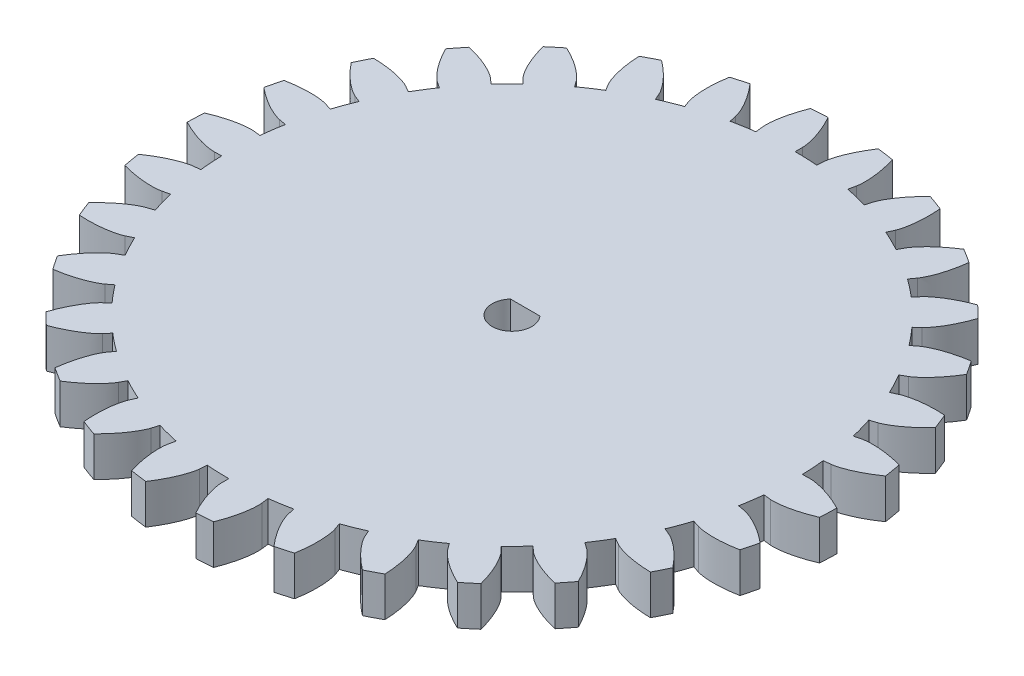
from build123d import *

# Parameters (mm, degrees)
GEAR_BILLET_R             = 24.96
GEAR_BILLET_EXTRUDE_DEPTH = 3
CUT_TOOTH_PROFILE_REACH   = 37.426
DUPLICATE_TEETH_COUNT     = 30
CUT_EXTRUDE1_DEPTH        = 36.41032234


with BuildPart() as part:
    # Gear billet → Gear billet Extrude (new body)
    with BuildSketch(Plane(origin=(0, 0, 0), x_dir=(1, 0, 0), z_dir=(0, 1, 0))):
        with Locations(Location((0, 0, 0), (0, 0, 270))):
            Circle(GEAR_BILLET_R)
    extrude(amount=GEAR_BILLET_EXTRUDE_DEPTH)

    # Tooth profile → Cut tooth profile (cut, up to next)
    with BuildSketch(Plane(origin=(0, 3, 0), x_dir=(1, 0, 0), z_dir=(0, 1, 0)), mode=Mode.PRIVATE) as cut_tooth_profile_sk1:
        with BuildLine():
            Line((0, 21.988807326), (0, 21.45))
            ThreePointArc((0, 21.45), (0.848990375, 21.433191907), (1.696650222, 21.382793971))
            Line((1.696650222, 21.382793971), (1.739268757, 21.919913135))
            add(Edge.make_bspline(
                [(1.739268757, 21.919913135), (1.741950544, 21.953711555), (1.749331215, 22.021073566), (1.780575487, 22.208729299), (1.867166111, 22.560964541), (2.04601574, 23.087806513), (2.341115229, 23.742388429), (2.630967732, 24.262304255), (2.855179999, 24.620366529), (2.962478695, 24.783569557)],
                knots=[0, 0, 0, 0, 0, 0.002802036, 0.005604071, 0.015718253, 0.029959921, 0.048733673, 0.064883743, 0.064883743, 0.064883743, 0.064883743, 0.064883743], degree=4))
            ThreePointArc((2.962478695, 24.783569557), (0.987916072, 24.940441492), (-0.992868196, 24.940244841))
            add(Edge.make_bspline(
                [(0, 21.988807326), (0, 22.022711975), (-0.002029352, 22.090446727), (-0.018332554, 22.279985863), (-0.076790805, 22.637966638), (-0.213407971, 23.177304568), (-0.455806807, 23.853177335), (-0.703626902, 24.394390915), (-0.898814701, 24.76906605), (-0.992868196, 24.940244841)],
                knots=[0, 0, 0, 0, 0, 0.002802036, 0.005604071, 0.015718253, 0.029959921, 0.048733673, 0.064883743, 0.064883743, 0.064883743, 0.064883743, 0.064883743], degree=4))
        make_face()
    cut_tooth_profile_tool1 = extrude(cut_tooth_profile_sk1.sketch, amount=-CUT_TOOTH_PROFILE_REACH, mode=Mode.PRIVATE) & part.part
    cut_tooth_profile = cut_tooth_profile_tool1.solids().sort_by_distance((0.928804, 3, -23.448139))[0]
    add(cut_tooth_profile, mode=Mode.SUBTRACT)

    # Duplicate teeth: Cut tooth profile ×30 about axis
    duplicate_teeth_axis = Axis((0, 3, 0), (0, -1, 0))
    for i in range(1, DUPLICATE_TEETH_COUNT):
        add(cut_tooth_profile.rotate(duplicate_teeth_axis, i * 360 / DUPLICATE_TEETH_COUNT), mode=Mode.SUBTRACT)

    # Sketch1 → Cut-Extrude1 (cut, through all)
    with BuildSketch(Plane(origin=(0, 3, 0), x_dir=(1, 0, 0), z_dir=(0, 1, 0))):
        with BuildLine():
            Line((-1.118033989, 1), (1.118033989, 1))
            ThreePointArc((1.118033989, 1), (0, -1.5), (-1.118033989, 1))
        make_face()
    extrude(amount=-CUT_EXTRUDE1_DEPTH, mode=Mode.SUBTRACT)


solid = part.part
